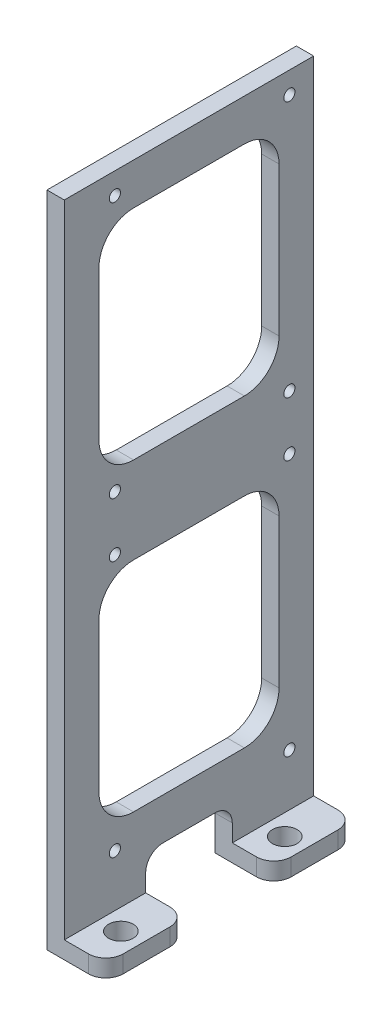
from build123d import *

# Parameters (mm, degrees)
SKETCH1_W                    = 45.72
SKETCH1_H                    = 120.65
BOSS_EXTRUDE1_DEPTH          = 3.175
SKETCH2_W                    = 45.72
SKETCH2_H                    = 3.175
BOSS_EXTRUDE2_DEPTH          = 7.62
SKETCH3_W                    = 10.795
SKETCH3_H                    = 15.875
CUT_EXTRUDE1_DEPTH           = 9.525
M4_CLEARANCE_HOLE1_D         = 4.5
FILLET1_R                    = 3.175
FILLET2_R                    = 3.175
M2_5X0_45_TAPPED_HOLE1_D     = 2.05
M2_5X0_45_TAPPED_HOLE1_DEPTH = 6.35
M2_5X0_45_TAPPED_HOLE1_TIP   = 0.615882135
SKETCH10_W                   = 33.02
SKETCH10_H                   = 40.005
CUT_EXTRUDE2_DEPTH           = 65.959599945
FILLET3_R                    = 6.35


with BuildPart() as part:
    # Sketch1 → Boss-Extrude1 (new body)
    with BuildSketch(Plane(origin=(0, 0, 0), x_dir=(0, 0, -1), z_dir=(1, 0, 0))):
        Rectangle(SKETCH1_W, SKETCH1_H)
    extrude(amount=BOSS_EXTRUDE1_DEPTH)

    # Sketch2 → Boss-Extrude2 (add)
    with BuildSketch(Plane(origin=(3.175, 0, 0), x_dir=(0, 0, -1), z_dir=(1, 0, 0))):
        with Locations((0, -58.7375)):
            Rectangle(SKETCH2_W, SKETCH2_H)
    extrude(amount=BOSS_EXTRUDE2_DEPTH)

    # Sketch3 → Cut-Extrude1 (cut)
    with BuildSketch(Plane.XZ.offset(60.325)):
        with Locations((5.3975, 0)):
            Rectangle(SKETCH3_W, SKETCH3_H)
    extrude(amount=-CUT_EXTRUDE1_DEPTH, mode=Mode.SUBTRACT)

    # M4 Clearance Hole1 (through all)
    with Locations(Plane(origin=(0, -57.15, 0), x_dir=(-1, 0, 0), z_dir=(0, 1, 0))):
        with Locations((-6.985, -13.7560191), (-6.985, 16.2960191)):
            Hole(M4_CLEARANCE_HOLE1_D / 2)

    # Fillet1
    fillet1_edges = [part.edges().sort_by_distance(p)[0] for p in [
        (1.5875, -50.8, -7.9375),
        (1.5875, -50.8, 7.9375),
    ]]
    fillet(fillet1_edges, radius=FILLET1_R)

    # Fillet2
    fillet2_edges = [part.edges().sort_by_distance(p)[0] for p in [
        (10.795, -58.7375, -22.86),
        (10.795, -58.7375, -7.9375),
        (10.795, -58.7375, 22.86),
        (10.795, -58.7375, 7.9375),
    ]]
    fillet(fillet2_edges, radius=FILLET2_R)

    # M2.5x0.45 Tapped Hole1
    with Locations(Plane(origin=(3.175, 0, 0), x_dir=(0, 0, -1), z_dir=(1, 0, 0))):
        with Locations((-13.585, -47.625), (18.415, -47.625), (18.415, -0.625), (-13.585, -0.625), (-13.585, 9.375), (18.415, 9.375), (18.415, 56.375), (-13.585, 56.375)):
            Hole(M2_5X0_45_TAPPED_HOLE1_D / 2, depth=M2_5X0_45_TAPPED_HOLE1_DEPTH)
            with Locations((0, 0, -(M2_5X0_45_TAPPED_HOLE1_DEPTH + M2_5X0_45_TAPPED_HOLE1_TIP / 2))):  # 118° drill point
                Cone(0, M2_5X0_45_TAPPED_HOLE1_D / 2, M2_5X0_45_TAPPED_HOLE1_TIP, mode=Mode.SUBTRACT)

    # Sketch10 → Cut-Extrude2 (cut, through all)
    with BuildSketch(Plane(origin=(3.175, 0, 0), x_dir=(0, 0, -1), z_dir=(1, 0, 0))):
        with Locations((0, 32.7025)):
            Rectangle(SKETCH10_W, SKETCH10_H)
        with Locations((0, -23.1775)):
            Rectangle(SKETCH10_W, SKETCH10_H)
    extrude(amount=-CUT_EXTRUDE2_DEPTH, mode=Mode.SUBTRACT)

    # Fillet3
    fillet3_edges = [part.edges().sort_by_distance(p)[0] for p in [
        (1.5875, 52.705, -16.51),
        (1.5875, 12.7, -16.51),
        (1.5875, 12.7, 16.51),
        (1.5875, 52.705, 16.51),
        (1.5875, -3.175, -16.51),
        (1.5875, -43.18, -16.51),
        (1.5875, -43.18, 16.51),
        (1.5875, -3.175, 16.51),
    ]]
    fillet(fillet3_edges, radius=FILLET3_R)


solid = part.part
